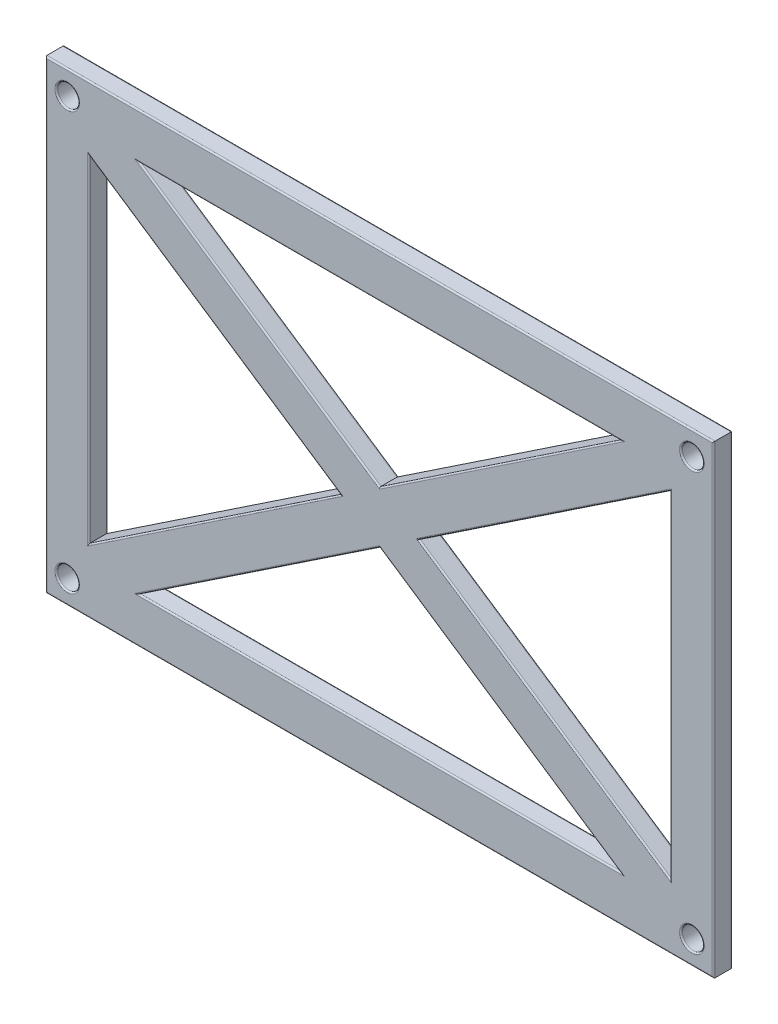
from build123d import *

# Parameters (mm, degrees)
SKETCH_1_W          = 92
SKETCH_1_H          = 64
SKETCH_1_R          = 1.5
EXTRUDE_1_DEPTH     = 2.6
CUT_EXTRUDE_1_DEPTH = 2.6
FILLET_1_R          = 0.2


with BuildPart() as part:
    # 草图1 → 凸台-拉伸1 (new body)
    with BuildSketch(Plane.XY):
        Rectangle(SKETCH_1_W, SKETCH_1_H)
        with Locations((-43, 28.75)):
            Circle(SKETCH_1_R, mode=Mode.SUBTRACT)
        with Locations((43, 28.75)):
            Circle(SKETCH_1_R, mode=Mode.SUBTRACT)
        with Locations((-43, -28.75)):
            Circle(SKETCH_1_R, mode=Mode.SUBTRACT)
        with Locations((43, -28.75)):
            Circle(SKETCH_1_R, mode=Mode.SUBTRACT)
    extrude(amount=EXTRUDE_1_DEPTH)

    # 草图2 → 切除-拉伸1 (cut)
    with BuildSketch(Plane.XY.offset(2.6)):
        Polygon((33.115564546, 25.75), (-33.115564546, 25.75), (0, 3.608779519), align=None)
        Polygon((-33.115564546, -25.75), (33.115564546, -25.75), (0, -3.608779519), align=None)
        Polygon((40, 23.135406528), (5.397478933, 0), (40, -23.135406528), align=None)
        Polygon((-5.397478933, 0), (-40, 23.135406528), (-40, -23.135406528), align=None)
    extrude(amount=-CUT_EXTRUDE_1_DEPTH, mode=Mode.SUBTRACT)

    # 圆角1
    fillet_1_edges = [part.edges().sort_by_distance(p)[0] for p in [
        (-44.5, 28.75, 0),
        (-44.5, 28.75, 2.6),
        (-46, 0, 2.6),
        (41.5, 28.75, 0),
        (41.5, 28.75, 2.6),
        (0, -32, 2.6),
        (-44.5, -28.75, 0),
        (-44.5, -28.75, 2.6),
        (41.5, -28.75, 0),
        (41.5, -28.75, 2.6),
        (40, 0, 2.6),
        (22.698739466, -11.567703264, 2.6),
        (22.698739466, 11.567703264, 2.6),
        (40, 0, 0),
        (22.698739466, -11.567703264, 0),
        (22.698739466, 11.567703264, 0),
        (0, -25.75, 0),
        (-16.557782273, -14.679389759, 0),
        (46, 0, 2.6),
        (0, -32, 0),
        (16.557782273, -14.679389759, 0),
        (0, -25.75, 2.6),
        (16.557782273, -14.679389759, 2.6),
        (-16.557782273, -14.679389759, 2.6),
        (-46, 0, 0),
        (-22.698739466, 11.567703264, 2.6),
        (-22.698739466, -11.567703264, 2.6),
        (-40, 0, 0),
        (-22.698739466, 11.567703264, 0),
        (-22.698739466, -11.567703264, 0),
        (-40, 0, 2.6),
        (0, 32, 0),
        (0, 25.75, 2.6),
        (16.557782273, 14.679389759, 0),
        (-16.557782273, 14.679389759, 0),
        (0, 25.75, 0),
        (-16.557782273, 14.679389759, 2.6),
        (16.557782273, 14.679389759, 2.6),
        (46, 0, 0),
        (0, 32, 2.6),
    ]]
    fillet(fillet_1_edges, radius=FILLET_1_R)


solid = part.part
